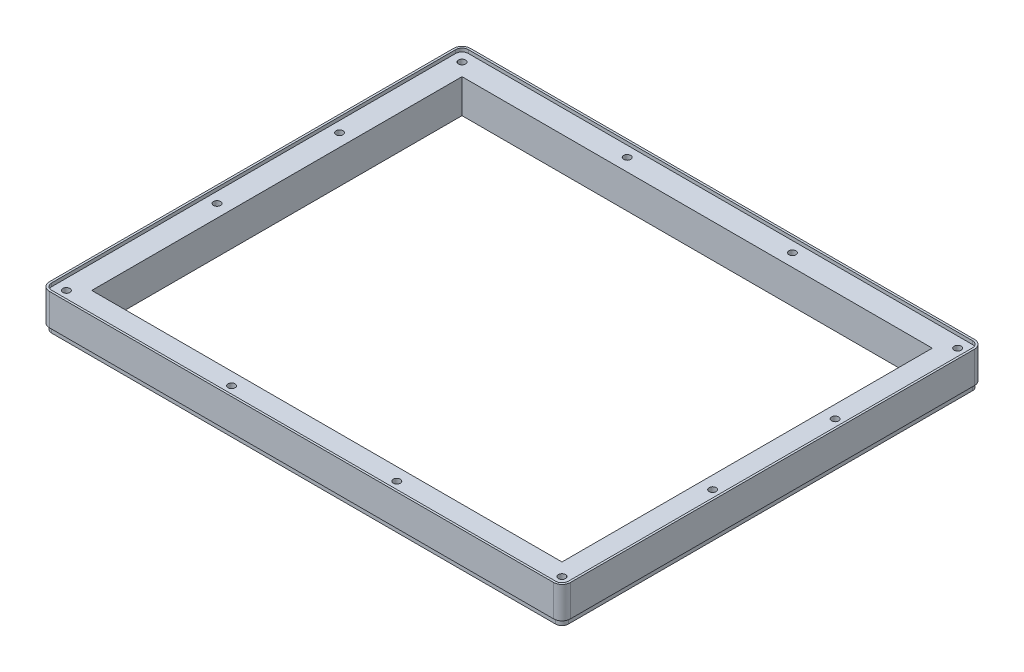
from build123d import *

# Parameters (mm, degrees)
SKETCH1_W           = 164.87
SKETCH1_H           = 104.3
SKETCH1_W_2         = 154.97
SKETCH1_H_2         = 94.47
BOSS_EXTRUDE1_DEPTH = 12
CUT_EXTRUDE3_REACH  = 229.35
SKETCH2_R           = 1.25
BOSS_EXTRUDE2_START = -13.2
BOSS_EXTRUDE2_DEPTH = 1.2
CUT_EXTRUDE4_REACH  = 229.416
SKETCH13_W          = 166.97
SKETCH13_H          = 131.47
CUT_EXTRUDE5_START  = -2
CUT_EXTRUDE5_DEPTH  = 2


with BuildPart() as part:
    # Sketch1 → Boss-Extrude1 (new body)
    # profile 1 of 3: a face of its own
    with BuildSketch(Plane(origin=(0, 0, 0), x_dir=(1, 0, 0), z_dir=(0, 1, 0))):
        with BuildLine():
            ThreePointArc((174.2, 7.54), (176.321320344, 6.661320344), (177.2, 4.54))
            Line((177.2, 4.54), (177.2, -138.93))
            ThreePointArc((177.2, -138.93), (176.321320344, -141.051320344), (174.2, -141.93))
            Line((174.2, -141.93), (-4.77, -141.93))
            ThreePointArc((-4.77, -141.93), (-6.891320344, -141.051320344), (-7.77, -138.93))
            Line((-7.77, -138.93), (-7.77, 4.54))
            ThreePointArc((-7.77, 4.54), (-6.891320344, 6.661320344), (-4.77, 7.54))
            Line((-4.77, 7.54), (174.2, 7.54))
        make_face()
        with Locations((82.435, -52.15)):
            Rectangle(SKETCH1_W, SKETCH1_H, mode=Mode.SUBTRACT)
    # profile 2 of 3: a face of its own
    with BuildSketch(Plane(origin=(0, 0, 0), x_dir=(1, 0, 0), z_dir=(0, 1, 0))):
        with Locations((82.435, -52.15)):
            Rectangle(SKETCH1_W, SKETCH1_H)
        with Locations((84.715, -54.695)):
            Rectangle(SKETCH1_W_2, SKETCH1_H_2, mode=Mode.SUBTRACT)
    # profile 3 of 3: a face of its own
    with BuildSketch(Plane(origin=(0, 0, 0), x_dir=(1, 0, 0), z_dir=(0, 1, 0))):
        with Locations((84.715, -54.695)):
            Rectangle(SKETCH1_W_2, SKETCH1_H_2)
    extrude(amount=-BOSS_EXTRUDE1_DEPTH)

    # Sketch2 → Cut-Extrude3 (cut, up to next)
    with BuildSketch(Plane.XZ.offset(12), mode=Mode.PRIVATE) as cut_extrude3_sk1:
        with Locations(Location((172.7, -3.04, 0), (0, 0, 270))):
            Circle(SKETCH2_R)
    cut_extrude3_tool1 = extrude(cut_extrude3_sk1.sketch, amount=-CUT_EXTRUDE3_REACH, mode=Mode.PRIVATE) & part.part
    # Sketch2 → Cut-Extrude3 (cut, up to next)
    with BuildSketch(Plane.XZ.offset(12), mode=Mode.PRIVATE) as cut_extrude3_sk2:
        with Locations(Location((114.05, -3.04, 0), (0, 0, 270))):
            Circle(SKETCH2_R)
    cut_extrude3_tool2 = extrude(cut_extrude3_sk2.sketch, amount=-CUT_EXTRUDE3_REACH, mode=Mode.PRIVATE) & part.part
    # Sketch2 → Cut-Extrude3 (cut, up to next)
    with BuildSketch(Plane.XZ.offset(12), mode=Mode.PRIVATE) as cut_extrude3_sk3:
        with Locations(Location((-3.27, -3.04, 0), (0, 0, 270))):
            Circle(SKETCH2_R)
    cut_extrude3_tool3 = extrude(cut_extrude3_sk3.sketch, amount=-CUT_EXTRUDE3_REACH, mode=Mode.PRIVATE) & part.part
    # Sketch2 → Cut-Extrude3 (cut, up to next)
    with BuildSketch(Plane.XZ.offset(12), mode=Mode.PRIVATE) as cut_extrude3_sk4:
        with Locations(Location((-3.27, 83.94, 0), (0, 0, 270))):
            Circle(SKETCH2_R)
    cut_extrude3_tool4 = extrude(cut_extrude3_sk4.sketch, amount=-CUT_EXTRUDE3_REACH, mode=Mode.PRIVATE) & part.part
    # Sketch2 → Cut-Extrude3 (cut, up to next)
    with BuildSketch(Plane.XZ.offset(12), mode=Mode.PRIVATE) as cut_extrude3_sk5:
        with Locations(Location((-3.27, 137.43, 0), (0, 0, 270))):
            Circle(SKETCH2_R)
    cut_extrude3_tool5 = extrude(cut_extrude3_sk5.sketch, amount=-CUT_EXTRUDE3_REACH, mode=Mode.PRIVATE) & part.part
    # Sketch2 → Cut-Extrude3 (cut, up to next)
    with BuildSketch(Plane.XZ.offset(12), mode=Mode.PRIVATE) as cut_extrude3_sk6:
        with Locations(Location((55.38, 137.43, 0), (0, 0, 270))):
            Circle(SKETCH2_R)
    cut_extrude3_tool6 = extrude(cut_extrude3_sk6.sketch, amount=-CUT_EXTRUDE3_REACH, mode=Mode.PRIVATE) & part.part
    # Sketch2 → Cut-Extrude3 (cut, up to next)
    with BuildSketch(Plane.XZ.offset(12), mode=Mode.PRIVATE) as cut_extrude3_sk7:
        with Locations(Location((114.05, 137.43, 0), (0, 0, 270))):
            Circle(SKETCH2_R)
    cut_extrude3_tool7 = extrude(cut_extrude3_sk7.sketch, amount=-CUT_EXTRUDE3_REACH, mode=Mode.PRIVATE) & part.part
    # Sketch2 → Cut-Extrude3 (cut, up to next)
    with BuildSketch(Plane.XZ.offset(12), mode=Mode.PRIVATE) as cut_extrude3_sk8:
        with Locations(Location((172.7, 137.43, 0), (0, 0, 270))):
            Circle(SKETCH2_R)
    cut_extrude3_tool8 = extrude(cut_extrude3_sk8.sketch, amount=-CUT_EXTRUDE3_REACH, mode=Mode.PRIVATE) & part.part
    # Sketch2 → Cut-Extrude3 (cut, up to next)
    with BuildSketch(Plane.XZ.offset(12), mode=Mode.PRIVATE) as cut_extrude3_sk9:
        with Locations(Location((172.7, 83.94, 0), (0, 0, 270))):
            Circle(SKETCH2_R)
    cut_extrude3_tool9 = extrude(cut_extrude3_sk9.sketch, amount=-CUT_EXTRUDE3_REACH, mode=Mode.PRIVATE) & part.part
    # Sketch2 → Cut-Extrude3 (cut, up to next)
    with BuildSketch(Plane.XZ.offset(12), mode=Mode.PRIVATE) as cut_extrude3_sk10:
        with Locations(Location((172.7, 40.45, 0), (0, 0, 270))):
            Circle(SKETCH2_R)
    cut_extrude3_tool10 = extrude(cut_extrude3_sk10.sketch, amount=-CUT_EXTRUDE3_REACH, mode=Mode.PRIVATE) & part.part
    # Sketch2 → Cut-Extrude3 (cut, up to next)
    with BuildSketch(Plane.XZ.offset(12), mode=Mode.PRIVATE) as cut_extrude3_sk11:
        with Locations(Location((55.38, -3.04, 0), (0, 0, 270))):
            Circle(SKETCH2_R)
    cut_extrude3_tool11 = extrude(cut_extrude3_sk11.sketch, amount=-CUT_EXTRUDE3_REACH, mode=Mode.PRIVATE) & part.part
    # Sketch2 → Cut-Extrude3 (cut, up to next)
    with BuildSketch(Plane.XZ.offset(12), mode=Mode.PRIVATE) as cut_extrude3_sk12:
        with Locations(Location((-3.27, 40.45, 0), (0, 0, 270))):
            Circle(SKETCH2_R)
    cut_extrude3_tool12 = extrude(cut_extrude3_sk12.sketch, amount=-CUT_EXTRUDE3_REACH, mode=Mode.PRIVATE) & part.part
    add(cut_extrude3_tool1.solids().sort_by_distance((172.7, -12, -3.04))[0], mode=Mode.SUBTRACT)
    add(cut_extrude3_tool2.solids().sort_by_distance((114.05, -12, -3.04))[0], mode=Mode.SUBTRACT)
    add(cut_extrude3_tool3.solids().sort_by_distance((-3.27, -12, -3.04))[0], mode=Mode.SUBTRACT)
    add(cut_extrude3_tool4.solids().sort_by_distance((-3.27, -12, 83.94))[0], mode=Mode.SUBTRACT)
    add(cut_extrude3_tool5.solids().sort_by_distance((-3.27, -12, 137.43))[0], mode=Mode.SUBTRACT)
    add(cut_extrude3_tool6.solids().sort_by_distance((55.38, -12, 137.43))[0], mode=Mode.SUBTRACT)
    add(cut_extrude3_tool7.solids().sort_by_distance((114.05, -12, 137.43))[0], mode=Mode.SUBTRACT)
    add(cut_extrude3_tool8.solids().sort_by_distance((172.7, -12, 137.43))[0], mode=Mode.SUBTRACT)
    add(cut_extrude3_tool9.solids().sort_by_distance((172.7, -12, 83.94))[0], mode=Mode.SUBTRACT)
    add(cut_extrude3_tool10.solids().sort_by_distance((172.7, -12, 40.45))[0], mode=Mode.SUBTRACT)
    add(cut_extrude3_tool11.solids().sort_by_distance((55.38, -12, -3.04))[0], mode=Mode.SUBTRACT)
    add(cut_extrude3_tool12.solids().sort_by_distance((-3.27, -12, 40.45))[0], mode=Mode.SUBTRACT)

    # Sketch12 → Boss-Extrude2 (add)
    with BuildSketch(Plane.XZ.offset(12).offset(BOSS_EXTRUDE2_START)):
        with BuildLine():
            Line((-4.77, -7.54), (174.2, -7.54))
            ThreePointArc((174.2, -7.54), (176.321320344, -6.661320344), (177.2, -4.54))
            Line((177.2, -4.54), (177.2, 138.93))
            ThreePointArc((177.2, 138.93), (176.321320344, 141.051320344), (174.2, 141.93))
            Line((174.2, 141.93), (-4.77, 141.93))
            ThreePointArc((-4.77, 141.93), (-6.891320344, 141.051320344), (-7.77, 138.93))
            Line((-7.77, 138.93), (-7.77, -4.54))
            ThreePointArc((-7.77, -4.54), (-6.891320344, -6.661320344), (-4.77, -7.54))
        make_face()
        with BuildLine():
            ThreePointArc((174.2, -6.79), (175.790990258, -6.130990258), (176.45, -4.54))
            Line((176.45, -4.54), (176.45, 138.93))
            ThreePointArc((176.45, 138.93), (175.790990258, 140.520990258), (174.2, 141.18))
            Line((174.2, 141.18), (-4.77, 141.18))
            ThreePointArc((-4.77, 141.18), (-6.360990258, 140.520990258), (-7.02, 138.93))
            Line((-7.02, 138.93), (-7.02, -4.54))
            ThreePointArc((-7.02, -4.54), (-6.360990258, -6.130990258), (-4.77, -6.79))
            Line((-4.77, -6.79), (174.2, -6.79))
        make_face(mode=Mode.SUBTRACT)
    extrude(amount=BOSS_EXTRUDE2_DEPTH)

    # Sketch13 → Cut-Extrude4 (cut, up to next)
    with BuildSketch(Plane.XZ.offset(12), mode=Mode.PRIVATE) as cut_extrude4_sk1:
        with Locations((84.715, 67.195)):
            Rectangle(SKETCH13_W, SKETCH13_H)
    cut_extrude4_tool1 = extrude(cut_extrude4_sk1.sketch, amount=-CUT_EXTRUDE4_REACH, mode=Mode.PRIVATE) & part.part
    add(cut_extrude4_tool1.solids().sort_by_distance((84.715, -12, 67.195))[0], mode=Mode.SUBTRACT)

    # Sketch12<4> → Cut-Extrude5 (cut)
    with BuildSketch(Plane.XZ.offset(12).offset(CUT_EXTRUDE5_START)):
        with BuildLine():
            Line((-4.77, -7.54), (174.2, -7.54))
            ThreePointArc((174.2, -7.54), (176.321320344, -6.661320344), (177.2, -4.54))
            Line((177.2, -4.54), (177.2, 138.93))
            ThreePointArc((177.2, 138.93), (176.321320344, 141.051320344), (174.2, 141.93))
            Line((174.2, 141.93), (-4.77, 141.93))
            ThreePointArc((-4.77, 141.93), (-6.891320344, 141.051320344), (-7.77, 138.93))
            Line((-7.77, 138.93), (-7.77, -4.54))
            ThreePointArc((-7.77, -4.54), (-6.891320344, -6.661320344), (-4.77, -7.54))
        make_face()
        with BuildLine():
            ThreePointArc((174.2, -6.79), (175.790990258, -6.130990258), (176.45, -4.54))
            Line((176.45, -4.54), (176.45, 138.93))
            ThreePointArc((176.45, 138.93), (175.790990258, 140.520990258), (174.2, 141.18))
            Line((174.2, 141.18), (-4.77, 141.18))
            ThreePointArc((-4.77, 141.18), (-6.360990258, 140.520990258), (-7.02, 138.93))
            Line((-7.02, 138.93), (-7.02, -4.54))
            ThreePointArc((-7.02, -4.54), (-6.360990258, -6.130990258), (-4.77, -6.79))
            Line((-4.77, -6.79), (174.2, -6.79))
        make_face(mode=Mode.SUBTRACT)
    extrude(amount=CUT_EXTRUDE5_DEPTH, mode=Mode.SUBTRACT)


solid = part.part
